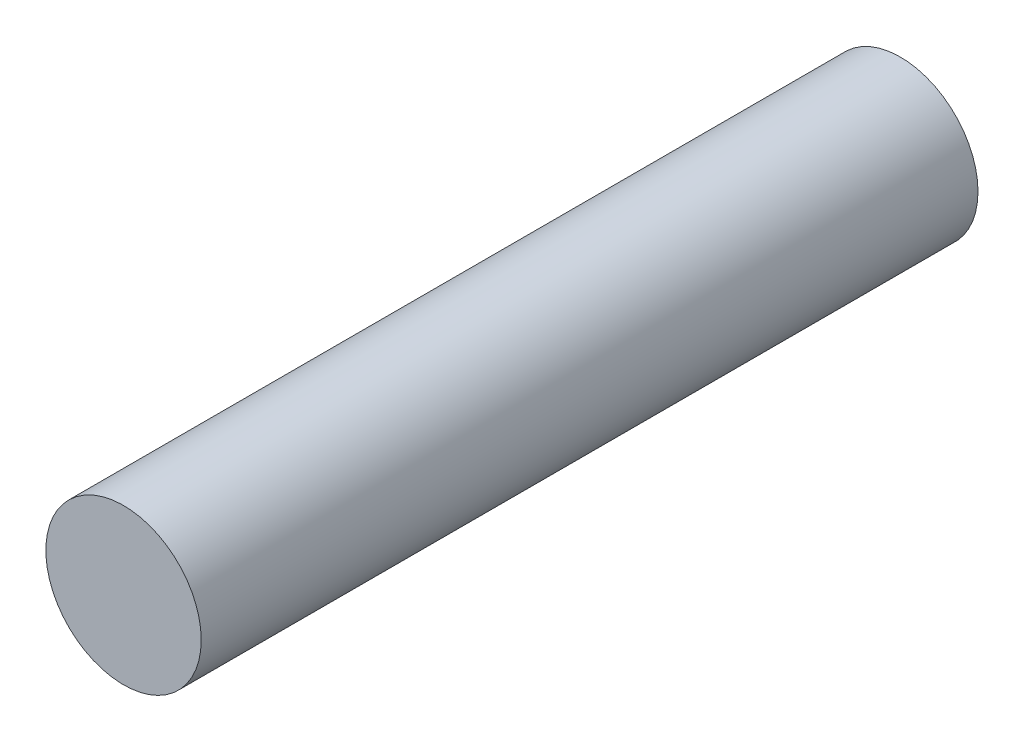
from build123d import *

# Parameters (mm, degrees)
SKETCH1_R           = 7.5
BOSS_EXTRUDE1_DEPTH = 75


with BuildPart() as part:
    # Sketch1 → Boss-Extrude1 (new body)
    with BuildSketch(Plane.XY):
        Circle(SKETCH1_R)
    extrude(amount=BOSS_EXTRUDE1_DEPTH)


solid = part.part
